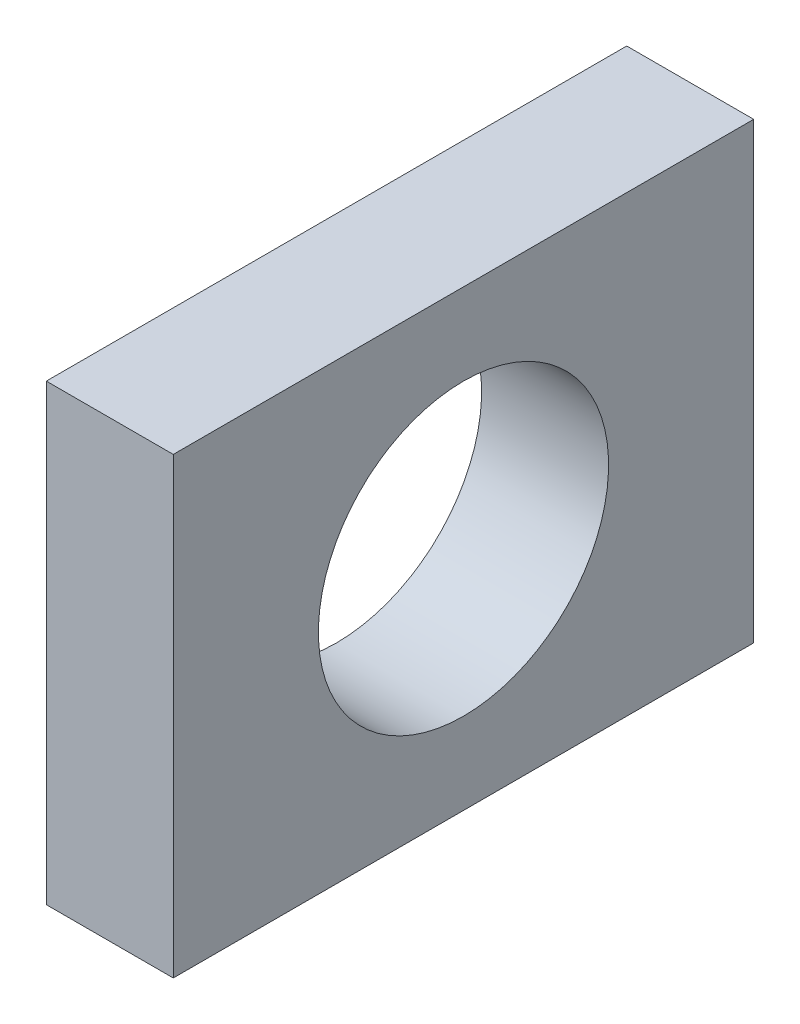
from build123d import *

# Parameters (mm, degrees)
SKETCH1_W           = 1.778
SKETCH1_H           = 6.35
BOSS_EXTRUDE1_DEPTH = 8.128
SKETCH2_R           = 2.032
CUT_EXTRUDE1_DEPTH  = 11.466526071


with BuildPart() as part:
    # Sketch1 → Boss-Extrude1 (new body)
    with BuildSketch(Plane.XY):
        with Locations((0.889, -3.175)):
            Rectangle(SKETCH1_W, SKETCH1_H)
    extrude(amount=BOSS_EXTRUDE1_DEPTH)

    # Sketch2 → Cut-Extrude1 (cut, through all)
    with BuildSketch(Plane.ZY):
        with Locations(Location((4.064, -3.175, 0), (0, 0, 270))):
            Circle(SKETCH2_R)
    extrude(amount=-CUT_EXTRUDE1_DEPTH, mode=Mode.SUBTRACT)


solid = part.part
